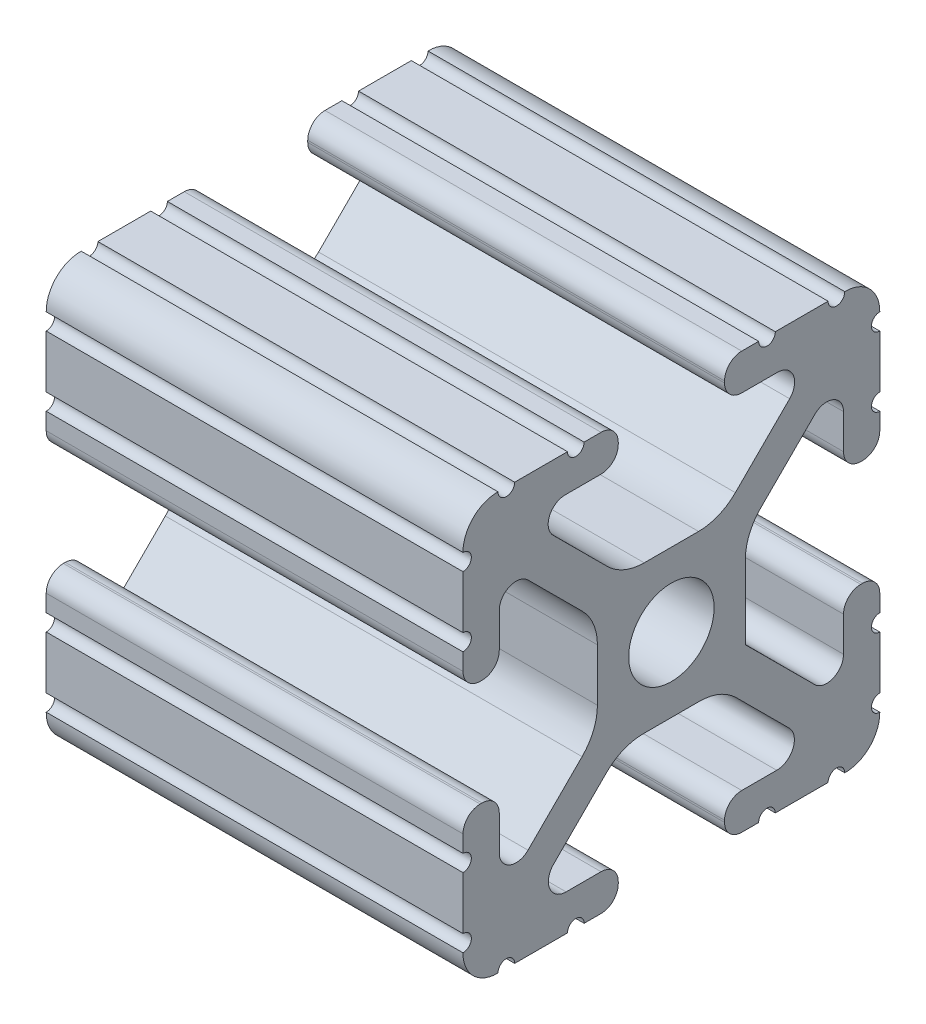
from build123d import *

# Parameters (mm, degrees)
SKETCH1_R           = 2.6035
BOSS_EXTRUDE1_DEPTH = 25.4


with BuildPart() as part:
    # Sketch1 → Boss-Extrude1 (new body)
    with BuildSketch(Plane(origin=(0, 0, 0), x_dir=(0, 0, -1), z_dir=(1, 0, 0))):
        with BuildLine():
            Line((6.333126718, -12.7), (9.550443118, -12.7))
            ThreePointArc((9.550443118, -12.7), (10.058366869, -12.192000006), (10.566443095, -12.699847501))
            ThreePointArc((10.566443095, -12.699847501), (12.082537762, -12.08250727), (12.699846982, -10.566399977))
            ThreePointArc((12.699846982, -10.566399977), (12.192000006, -10.058323491), (12.7, -9.5504))
            Line((12.7, -9.5504), (12.7, -6.3330836))
            ThreePointArc((12.7, -6.3330836), (12.192, -5.8250836), (12.7, -5.3170836))
            Line((12.7, -5.3170836), (12.7, -4.287469289))
            ThreePointArc((12.7, -4.287469289), (12.39275138, -3.545705502), (11.650987593, -3.238456882))
            Line((11.650987593, -3.238456882), (11.539212407, -3.238456882))
            ThreePointArc((11.539212407, -3.238456882), (10.79744862, -3.545705502), (10.4902, -4.287469289))
            Line((10.4902, -4.287469289), (10.4902, -6.402089023))
            ThreePointArc((10.4902, -6.402089023), (9.856505071, -7.351067942), (8.737131347, -7.129408934))
            Line((8.737131347, -7.129408934), (4.5085, -2.9104418))
            Line((4.5085, -2.9104418), (4.5085, 1.593185507))
            ThreePointArc((4.5085, 1.593185507), (4.750877967, 2.809883091), (5.441005833, 3.840816462))
            Line((5.441005833, 3.840816462), (8.737131347, 7.129408934))
            ThreePointArc((8.737131347, 7.129408934), (9.856505071, 7.351067942), (10.4902, 6.402089023))
            Line((10.4902, 6.402089023), (10.4902, 4.287469289))
            ThreePointArc((10.4902, 4.287469289), (10.79744862, 3.545705502), (11.539212407, 3.238456882))
            Line((11.539212407, 3.238456882), (11.650987593, 3.238456882))
            ThreePointArc((11.650987593, 3.238456882), (12.39275138, 3.545705502), (12.7, 4.287469289))
            Line((12.7, 4.287469289), (12.7, 5.3170836))
            ThreePointArc((12.7, 5.3170836), (12.192, 5.8250836), (12.7, 6.3330836))
            Line((12.7, 6.3330836), (12.7, 9.5504))
            ThreePointArc((12.7, 9.5504), (12.192000006, 10.058323491), (12.699846982, 10.566399977))
            ThreePointArc((12.699846982, 10.566399977), (12.082537762, 12.08250727), (10.566443095, 12.699847501))
            ThreePointArc((10.566443095, 12.699847501), (10.058366869, 12.192000006), (9.550443118, 12.7))
            Line((9.550443118, 12.7), (6.333126718, 12.7))
            ThreePointArc((6.333126718, 12.7), (5.825126718, 12.192), (5.317126718, 12.7))
            Line((5.317126718, 12.7), (4.287512407, 12.7))
            ThreePointArc((4.287512407, 12.7), (3.54574862, 12.39275138), (3.2385, 11.650987593))
            Line((3.2385, 11.650987593), (3.2385, 11.539212407))
            ThreePointArc((3.2385, 11.539212407), (3.54574862, 10.79744862), (4.287512407, 10.4902))
            Line((4.287512407, 10.4902), (6.476788598, 10.4902))
            ThreePointArc((6.476788598, 10.4902), (7.432222385, 9.85140422), (7.207036008, 8.724370562))
            Line((7.207036008, 8.724370562), (3.898272566, 5.423169045))
            ThreePointArc((3.898272566, 5.423169045), (2.869120213, 4.736787962), (1.655778399, 4.4958))
            Line((1.655778399, 4.4958), (-1.655778399, 4.4958))
            ThreePointArc((-1.655778399, 4.4958), (-2.869120213, 4.736787962), (-3.898272566, 5.423169045))
            Line((-3.898272566, 5.423169045), (-7.207036008, 8.724370562))
            ThreePointArc((-7.207036008, 8.724370562), (-7.432222385, 9.85140422), (-6.476788598, 10.4902))
            Line((-6.476788598, 10.4902), (-4.287512407, 10.4902))
            ThreePointArc((-4.287512407, 10.4902), (-3.54574862, 10.79744862), (-3.2385, 11.539212407))
            Line((-3.2385, 11.539212407), (-3.2385, 11.650987593))
            ThreePointArc((-3.2385, 11.650987593), (-3.54574862, 12.39275138), (-4.287512407, 12.7))
            Line((-4.287512407, 12.7), (-5.317126718, 12.7))
            ThreePointArc((-5.317126718, 12.7), (-5.825126718, 12.192), (-6.333126718, 12.7))
            Line((-6.333126718, 12.7), (-9.550443118, 12.7))
            ThreePointArc((-9.550443118, 12.7), (-10.058366869, 12.192000006), (-10.566443095, 12.699847501))
            ThreePointArc((-10.566443095, 12.699847501), (-12.082537762, 12.08250727), (-12.699846982, 10.566399977))
            ThreePointArc((-12.699846982, 10.566399977), (-12.192000006, 10.058323491), (-12.7, 9.5504))
            Line((-12.7, 9.5504), (-12.7, 6.3330836))
            ThreePointArc((-12.7, 6.3330836), (-12.192, 5.8250836), (-12.7, 5.3170836))
            Line((-12.7, 5.3170836), (-12.7, 4.287469289))
            ThreePointArc((-12.7, 4.287469289), (-12.39275138, 3.545705502), (-11.650987593, 3.238456882))
            Line((-11.650987593, 3.238456882), (-11.539212407, 3.238456882))
            ThreePointArc((-11.539212407, 3.238456882), (-10.79744862, 3.545705502), (-10.4902, 4.287469289))
            Line((-10.4902, 4.287469289), (-10.4902, 6.402089023))
            ThreePointArc((-10.4902, 6.402089023), (-9.856505071, 7.351067942), (-8.737131347, 7.129408934))
            Line((-8.737131347, 7.129408934), (-5.441005833, 3.840816462))
            ThreePointArc((-5.441005833, 3.840816462), (-4.750877967, 2.809883091), (-4.5085, 1.593185507))
            Line((-4.5085, 1.593185507), (-4.5085, -1.593185507))
            ThreePointArc((-4.5085, -1.593185507), (-4.750877967, -2.809883091), (-5.441005833, -3.840816462))
            Line((-5.441005833, -3.840816462), (-8.737131347, -7.129408934))
            ThreePointArc((-8.737131347, -7.129408934), (-9.856505071, -7.351067942), (-10.4902, -6.402089023))
            Line((-10.4902, -6.402089023), (-10.4902, -4.287469289))
            ThreePointArc((-10.4902, -4.287469289), (-10.79744862, -3.545705502), (-11.539212407, -3.238456882))
            Line((-11.539212407, -3.238456882), (-11.650987593, -3.238456882))
            ThreePointArc((-11.650987593, -3.238456882), (-12.39275138, -3.545705502), (-12.7, -4.287469289))
            Line((-12.7, -4.287469289), (-12.7, -5.3170836))
            ThreePointArc((-12.7, -5.3170836), (-12.192, -5.8250836), (-12.7, -6.3330836))
            Line((-12.7, -6.3330836), (-12.7, -9.5504))
            ThreePointArc((-12.7, -9.5504), (-12.192000006, -10.058323491), (-12.699846982, -10.566399977))
            ThreePointArc((-12.699846982, -10.566399977), (-12.082537762, -12.08250727), (-10.566443095, -12.699847501))
            ThreePointArc((-10.566443095, -12.699847501), (-10.058366869, -12.192000006), (-9.550443118, -12.7))
            Line((-9.550443118, -12.7), (-6.333126718, -12.7))
            ThreePointArc((-6.333126718, -12.7), (-5.825126718, -12.192), (-5.317126718, -12.7))
            Line((-5.317126718, -12.7), (-4.287512407, -12.7))
            ThreePointArc((-4.287512407, -12.7), (-3.54574862, -12.39275138), (-3.2385, -11.650987593))
            Line((-3.2385, -11.650987593), (-3.2385, -11.539212407))
            ThreePointArc((-3.2385, -11.539212407), (-3.54574862, -10.79744862), (-4.287512407, -10.4902))
            Line((-4.287512407, -10.4902), (-6.416408329, -10.4902))
            ThreePointArc((-6.416408329, -10.4902), (-7.41473083, -9.822813117), (-7.179650497, -8.645192506))
            Line((-7.179650497, -8.645192506), (-3.952270251, -5.423690499))
            ThreePointArc((-3.952270251, -5.423690499), (-2.922936451, -4.736929036), (-1.709253557, -4.4958))
            Line((-1.709253557, -4.4958), (1.709253557, -4.4958))
            ThreePointArc((1.709253557, -4.4958), (2.922936451, -4.736929036), (3.952270251, -5.423690499))
            Line((3.952270251, -5.423690499), (7.179650497, -8.645192506))
            ThreePointArc((7.179650497, -8.645192506), (7.41473083, -9.822813117), (6.416408329, -10.4902))
            Line((6.416408329, -10.4902), (4.287512407, -10.4902))
            ThreePointArc((4.287512407, -10.4902), (3.54574862, -10.79744862), (3.2385, -11.539212407))
            Line((3.2385, -11.539212407), (3.2385, -11.650987593))
            ThreePointArc((3.2385, -11.650987593), (3.54574862, -12.39275138), (4.287512407, -12.7))
            Line((4.287512407, -12.7), (5.317126718, -12.7))
            ThreePointArc((5.317126718, -12.7), (5.825126718, -12.192), (6.333126718, -12.7))
        make_face()
        Circle(SKETCH1_R, mode=Mode.SUBTRACT)
    extrude(amount=BOSS_EXTRUDE1_DEPTH)


solid = part.part
